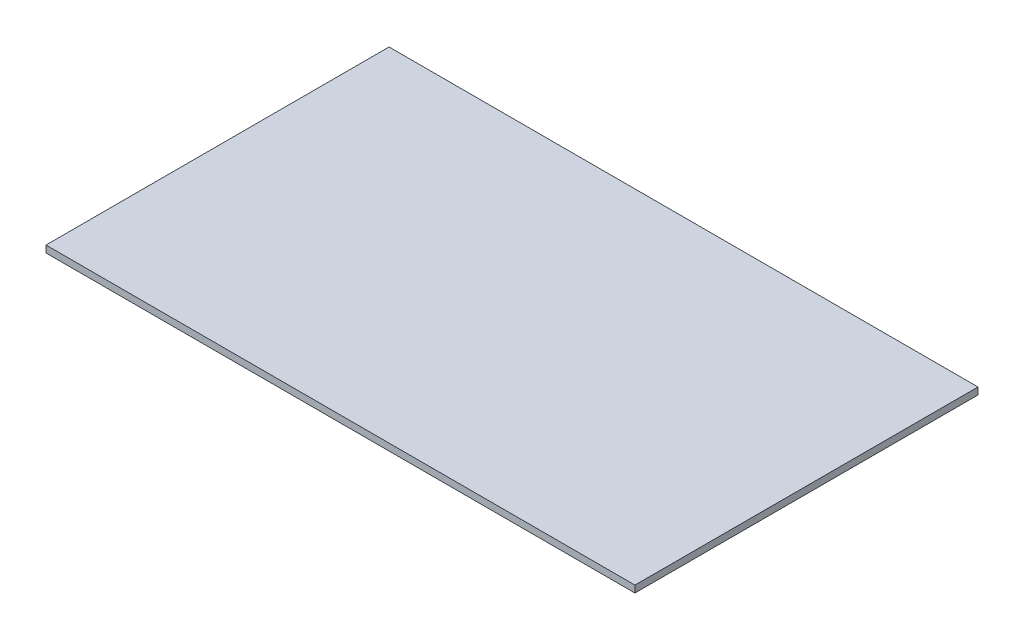
from build123d import *

# Parameters (mm, degrees)
SKETCH_1_W                     = 255.8
SKETCH_1_H                     = 3
V2_REF_CHASSIS_255P8X149_DEPTH = 149


with BuildPart() as part:
    # 草图1 → V2_REF_chassis_255p8x149 (new body)
    with BuildSketch(Plane.XY):
        with Locations((127.9, 1.5)):
            Rectangle(SKETCH_1_W, SKETCH_1_H)
    extrude(amount=V2_REF_CHASSIS_255P8X149_DEPTH)


solid = part.part
